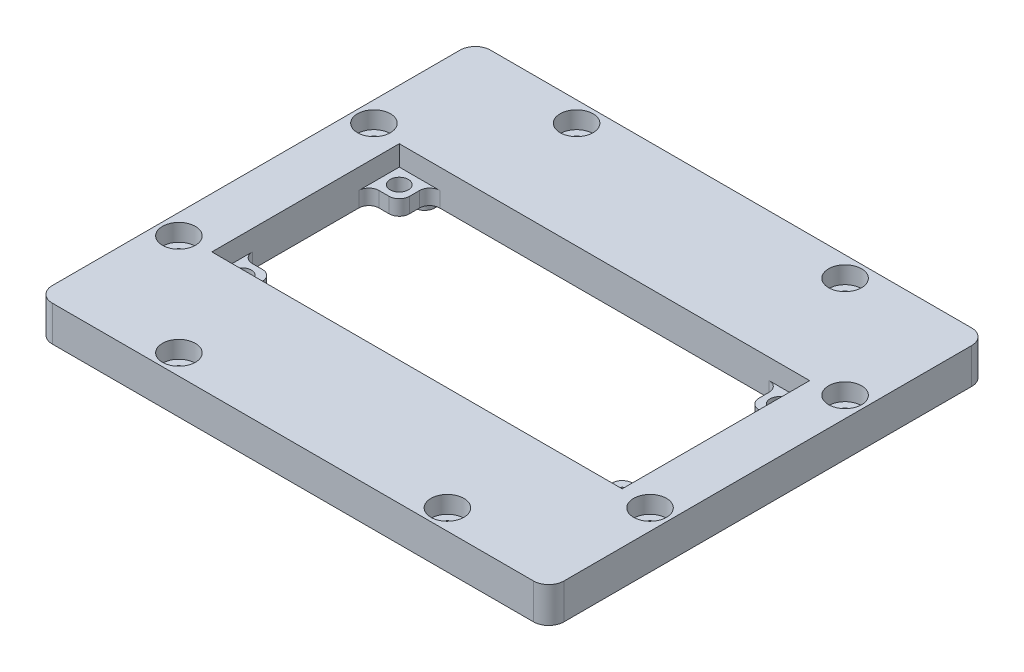
from build123d import *

# Parameters (mm, degrees)
SKETCH1_W                                           = 101
SKETCH1_H                                           = 86.5
BOSS_EXTRUDE1_DEPTH                                 = 7
CBORE_FOR_M3_HEX_SOCKET_HEAD_CAP_SCREW1_D           = 3.4
CBORE_FOR_M3_HEX_SOCKET_HEAD_CAP_SCREW1_CBORE_D     = 6.5
CBORE_FOR_M3_HEX_SOCKET_HEAD_CAP_SCREW1_CBORE_DEPTH = 3.4
BOSS_EXTRUDE2_DEPTH                                 = 4
FILLET1_R                                           = 2
FILLET2_R                                           = 3
CUT_EXTRUDE2_DEPTH                                  = 68.392970702
CUT_EXTRUDE2_DEPTH_BACK                             = 68.392970702
SKETCH11_W                                          = 81
SKETCH11_H                                          = 37
SKETCH13_W                                          = 6
SKETCH13_H                                          = 6
SKETCH13_R                                          = 1.8
BOSS_EXTRUDE3_DEPTH                                 = 3
FILLET3_R                                           = 2


with BuildPart() as part:
    # Sketch1 → Boss-Extrude1 (new body)
    with BuildSketch(Plane(origin=(0, 0, 0), x_dir=(1, 0, 0), z_dir=(0, 1, 0))):
        Rectangle(SKETCH1_W, SKETCH1_H)
    extrude(amount=BOSS_EXTRUDE1_DEPTH)

    # CBORE for M3 Hex Socket Head Cap Screw1 (through all)
    with Locations(Plane(origin=(0, 7, 0), x_dir=(1, 0, 0), z_dir=(0, 1, 0))):
        with Locations((26.5, 39.25), (46.5, 19.25), (46.5, -19.25), (26.5, -39.25), (-26.5, -39.25), (-46.5, -19.25), (-46.5, 19.25), (-26.5, 39.25)):
            CounterBoreHole(CBORE_FOR_M3_HEX_SOCKET_HEAD_CAP_SCREW1_D / 2, CBORE_FOR_M3_HEX_SOCKET_HEAD_CAP_SCREW1_CBORE_D / 2, CBORE_FOR_M3_HEX_SOCKET_HEAD_CAP_SCREW1_CBORE_DEPTH)

    # Sketch8 → Boss-Extrude2 (add)
    with BuildSketch(Plane.XZ):
        Polygon((42, -34.75), (27, -34.75), (27, -29.75), (37, -29.75), (37, -19.75), (42, -19.75), align=None)
        Polygon((-42, -19.75), (-42, -34.75), (-27, -34.75), (-27, -29.75), (-37, -29.75), (-37, -19.75), align=None)
        Polygon((-42, 34.75), (-27, 34.75), (-27, 29.75), (-37, 29.75), (-37, 19.75), (-42, 19.75), align=None)
        Polygon((42, 19.75), (42, 34.75), (27, 34.75), (27, 29.75), (37, 29.75), (37, 19.75), align=None)
    extrude(amount=BOSS_EXTRUDE2_DEPTH)

    # Fillet1
    fillet1_edges = [part.edges().sort_by_distance(p)[0] for p in [
        (42, -2, 34.75),
        (27, -2, 34.75),
        (27, -2, 29.75),
        (37, -2, 29.75),
        (37, -2, 19.75),
        (42, -2, 19.75),
        (-42, -2, -34.75),
        (-27, -2, -34.75),
        (-27, -2, -29.75),
        (-37, -2, -29.75),
        (-37, -2, -19.75),
        (-42, -2, -19.75),
        (-37, -2, 19.75),
        (-37, -2, 29.75),
        (-27, -2, 29.75),
        (-27, -2, 34.75),
        (-42, -2, 34.75),
        (-42, -2, 19.75),
        (42, -2, -34.75),
        (42, -2, -19.75),
        (37, -2, -19.75),
        (37, -2, -29.75),
        (27, -2, -29.75),
        (27, -2, -34.75),
    ]]
    fillet(fillet1_edges, radius=FILLET1_R)

    # Fillet2
    fillet2_edges = [part.edges().sort_by_distance(p)[0] for p in [
        (50.5, 3.5, 43.25),
        (-50.5, 3.5, 43.25),
        (-50.5, 3.5, -43.25),
        (50.5, 3.5, -43.25),
    ]]
    fillet(fillet2_edges, radius=FILLET2_R)

    # Sketch11 → Cut-Extrude2 (cut, two sides: drawn at the far end of the back side and taken through both)
    with BuildSketch(Plane(origin=(0, 7, 0), x_dir=(1, 0, 0), z_dir=(0, 1, 0)).offset(-CUT_EXTRUDE2_DEPTH_BACK)):
        with Locations((0, -0.25)):
            Rectangle(SKETCH11_W, SKETCH11_H)
    extrude(amount=CUT_EXTRUDE2_DEPTH + CUT_EXTRUDE2_DEPTH_BACK, mode=Mode.SUBTRACT)

    # Sketch13 → Boss-Extrude3 (add)
    # profile 1 of 4: a face of its own
    with BuildSketch(Plane.XZ):
        with Locations((-37.5, 15.75)):
            Rectangle(SKETCH13_W, SKETCH13_H)
        with Locations(Location((-37.5, 15.75, 0), (0, 0, 90))):
            Circle(SKETCH13_R, mode=Mode.SUBTRACT)
    # profile 2 of 4: a face of its own
    with BuildSketch(Plane.XZ):
        with Locations((-37.5, -15.25)):
            Rectangle(SKETCH13_W, SKETCH13_H)
        with Locations(Location((-37.5, -15.25, 0), (0, 0, 270))):
            Circle(SKETCH13_R, mode=Mode.SUBTRACT)
    # profile 3 of 4: a face of its own
    with BuildSketch(Plane.XZ):
        with Locations((37.5, 15.75)):
            Rectangle(SKETCH13_W, SKETCH13_H)
        with Locations(Location((37.5, 15.75, 0), (0, 0, 270))):
            Circle(SKETCH13_R, mode=Mode.SUBTRACT)
    # profile 4 of 4: a face of its own
    with BuildSketch(Plane.XZ):
        with Locations((37.5, -15.25)):
            Rectangle(SKETCH13_W, SKETCH13_H)
        with Locations(Location((37.5, -15.25, 0), (0, 0, 90))):
            Circle(SKETCH13_R, mode=Mode.SUBTRACT)
    extrude(amount=-BOSS_EXTRUDE3_DEPTH)

    # Fillet3
    fillet3_edges = [part.edges().sort_by_distance(p)[0] for p in [
        (-40.5, 1.5, -12.25),
        (-34.5, 1.5, -12.25),
        (-34.5, 1.5, -18.25),
        (-34.5, 1.5, 18.75),
        (-34.5, 1.5, 12.75),
        (-40.5, 1.5, 12.75),
        (40.5, 1.5, 12.75),
        (34.5, 1.5, 12.75),
        (34.5, 1.5, 18.75),
        (34.5, 1.5, -18.25),
        (34.5, 1.5, -12.25),
        (40.5, 1.5, -12.25),
    ]]
    fillet(fillet3_edges, radius=FILLET3_R)


solid = part.part
